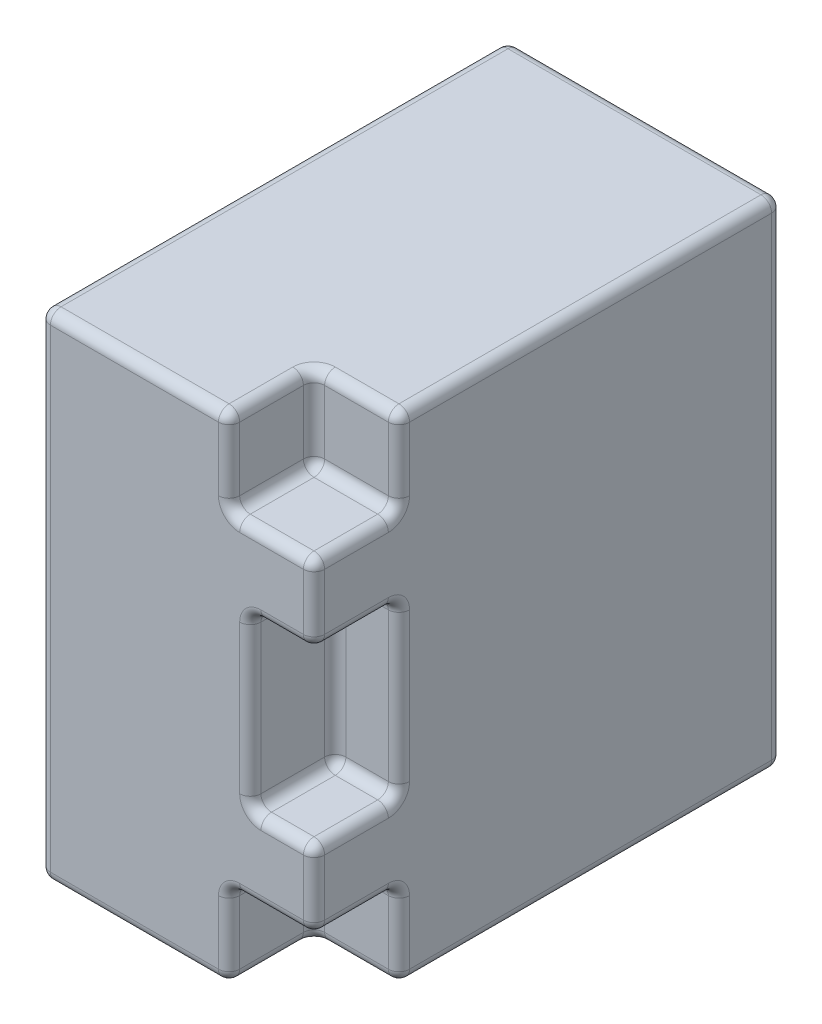
from build123d import *

# Parameters (mm, degrees)
SKETCH1_W           = 82
SKETCH1_H           = 148
BOSS_EXTRUDE1_DEPTH = 140
SKETCH2_W           = 25.4
SKETCH2_H           = 25.4
SKETCH2_W_2         = 19.05
SKETCH2_H_2         = 50.8
CUT_EXTRUDE1_DEPTH  = 25.4
FILLET1_R           = 3.175


with BuildPart() as part:
    # Sketch1 → Boss-Extrude1 (new body)
    with BuildSketch(Plane.XY):
        Rectangle(SKETCH1_W, SKETCH1_H)
    extrude(amount=BOSS_EXTRUDE1_DEPTH)

    # Sketch2 → Cut-Extrude1 (cut)
    with BuildSketch(Plane.XY.offset(140)):
        with Locations((28.3, -61.3)):
            Rectangle(SKETCH2_W, SKETCH2_H)
        with Locations((28.3, 61.3)):
            Rectangle(SKETCH2_W, SKETCH2_H)
        with Locations((31.475, 0)):
            Rectangle(SKETCH2_W_2, SKETCH2_H_2)
    extrude(amount=-CUT_EXTRUDE1_DEPTH, mode=Mode.SUBTRACT)

    # Fillet1
    fillet1_edges = [part.edges().sort_by_distance(p)[0] for p in [
        (41, -37, 140),
        (41, 37, 140),
        (-12.7, 74, 140),
        (41, 74, 57.3),
        (41, -74, 57.3),
        (41, -61.3, 114.6),
        (41, -48.6, 127.3),
        (28.3, -74, 114.6),
        (15.6, -61.3, 114.6),
        (15.6, -74, 127.3),
        (28.3, -48.6, 114.6),
        (15.6, -48.6, 127.3),
        (28.3, -48.6, 140),
        (15.6, -61.3, 140),
        (41, 61.3, 114.6),
        (28.3, 48.6, 114.6),
        (41, 48.6, 127.3),
        (15.6, 61.3, 114.6),
        (15.6, 48.6, 127.3),
        (28.3, 74, 114.6),
        (15.6, 74, 127.3),
        (15.6, 61.3, 140),
        (28.3, 48.6, 140),
        (41, 0, 114.6),
        (41, 25.4, 127.3),
        (31.475, -25.4, 114.6),
        (41, -25.4, 127.3),
        (21.95, 0, 114.6),
        (21.95, -25.4, 127.3),
        (31.475, 25.4, 114.6),
        (21.95, 25.4, 127.3),
        (31.475, 25.4, 140),
        (21.95, 0, 140),
        (31.475, -25.4, 140),
        (-41, 0, 140),
        (0, 74, 0),
        (41, 0, 0),
        (0, -74, 0),
        (-41, 0, 0),
        (-41, 74, 70),
        (-41, -74, 70),
        (-12.7, -74, 140),
    ]]
    fillet(fillet1_edges, radius=FILLET1_R)


solid = part.part
